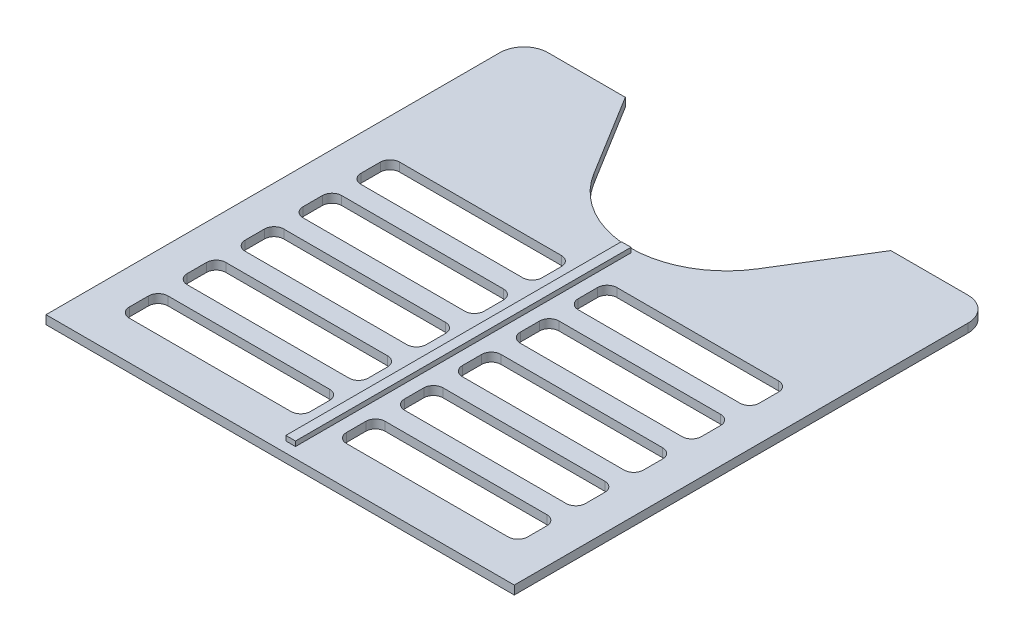
from build123d import *

# Parameters (mm, degrees)
GRUNDK_RPER_DEPTH = 1.8
L_FTUNGEN_DEPTH   = 1.8
SKIZZE4_W         = 2
SKIZZE4_H         = 69.501766887
STREBE_DEPTH      = 1


with BuildPart() as part:
    # Skizze2 → Grundkörper (new body)
    with BuildSketch(Plane(origin=(0, 0, 0), x_dir=(1, 0, 0), z_dir=(0, 1, 0))):
        with BuildLine():
            Line((-43.5, 50), (-27.5, 50))
            Line((-27.5, 50), (-17.028881642, 33))
            ThreePointArc((-17.028881642, 33), (0, 23.488907952), (17.028881642, 33))
            Line((17.028881642, 33), (27.5, 50))
            Line((27.5, 50), (43.5, 50))
            ThreePointArc((43.5, 50), (47.035533906, 48.535533906), (48.5, 45))
            Line((48.5, 45), (48.5, -49))
            Line((48.5, -49), (-48.5, -49))
            Line((-48.5, -49), (-48.5, 45))
            ThreePointArc((-48.5, 45), (-47.035533906, 48.535533906), (-43.5, 50))
        make_face()
    extrude(amount=GRUNDK_RPER_DEPTH)

    # Skizze3 → Lüftungen (cut)
    with BuildSketch(Plane(origin=(0, 1.8, 0), x_dir=(1, 0, 0), z_dir=(0, 1, 0))):
        with BuildLine():
            Line((-39.25, 15), (-5.75, 15))
            ThreePointArc((-5.75, 15), (-4.335786438, 14.414213562), (-3.75, 13))
            Line((-3.75, 13), (-3.75, 9))
            ThreePointArc((-3.75, 9), (-4.335786438, 7.585786438), (-5.75, 7))
            Line((-5.75, 7), (-39.25, 7))
            ThreePointArc((-39.25, 7), (-40.664213562, 7.585786438), (-41.25, 9))
            Line((-41.25, 9), (-41.25, 13))
            ThreePointArc((-41.25, 13), (-40.664213562, 14.414213562), (-39.25, 15))
        make_face()
        with BuildLine():
            Line((3.75, 13), (3.75, 9))
            ThreePointArc((3.75, 9), (4.335786438, 7.585786438), (5.75, 7))
            Line((5.75, 7), (39.25, 7))
            ThreePointArc((39.25, 7), (40.664213562, 7.585786438), (41.25, 9))
            Line((41.25, 9), (41.25, 13))
            ThreePointArc((41.25, 13), (40.664213562, 14.414213562), (39.25, 15))
            Line((39.25, 15), (5.75, 15))
            ThreePointArc((5.75, 15), (4.335786438, 14.414213562), (3.75, 13))
        make_face()
        with BuildLine():
            Line((3.75, 1), (3.75, -3))
            ThreePointArc((3.75, -3), (4.335786438, -4.414213562), (5.75, -5))
            Line((5.75, -5), (39.25, -5))
            ThreePointArc((39.25, -5), (40.664213562, -4.414213562), (41.25, -3))
            Line((41.25, -3), (41.25, 1))
            ThreePointArc((41.25, 1), (40.664213562, 2.414213562), (39.25, 3))
            Line((39.25, 3), (5.75, 3))
            ThreePointArc((5.75, 3), (4.335786438, 2.414213562), (3.75, 1))
        make_face()
        with BuildLine():
            Line((3.75, -11), (3.75, -15))
            ThreePointArc((3.75, -15), (4.335786438, -16.414213562), (5.75, -17))
            Line((5.75, -17), (39.25, -17))
            ThreePointArc((39.25, -17), (40.664213562, -16.414213562), (41.25, -15))
            Line((41.25, -15), (41.25, -11))
            ThreePointArc((41.25, -11), (40.664213562, -9.585786438), (39.25, -9))
            Line((39.25, -9), (5.75, -9))
            ThreePointArc((5.75, -9), (4.335786438, -9.585786438), (3.75, -11))
        make_face()
        with BuildLine():
            Line((3.75, -23), (3.75, -27))
            ThreePointArc((3.75, -27), (4.335786438, -28.414213562), (5.75, -29))
            Line((5.75, -29), (39.25, -29))
            ThreePointArc((39.25, -29), (40.664213562, -28.414213562), (41.25, -27))
            Line((41.25, -27), (41.25, -23))
            ThreePointArc((41.25, -23), (40.664213562, -21.585786438), (39.25, -21))
            Line((39.25, -21), (5.75, -21))
            ThreePointArc((5.75, -21), (4.335786438, -21.585786438), (3.75, -23))
        make_face()
        with BuildLine():
            Line((3.75, -35), (3.75, -39))
            ThreePointArc((3.75, -39), (4.335786438, -40.414213562), (5.75, -41))
            Line((5.75, -41), (39.25, -41))
            ThreePointArc((39.25, -41), (40.664213562, -40.414213562), (41.25, -39))
            Line((41.25, -39), (41.25, -35))
            ThreePointArc((41.25, -35), (40.664213562, -33.585786438), (39.25, -33))
            Line((39.25, -33), (5.75, -33))
            ThreePointArc((5.75, -33), (4.335786438, -33.585786438), (3.75, -35))
        make_face()
        with BuildLine():
            Line((-41.25, 1), (-41.25, -3))
            ThreePointArc((-41.25, -3), (-40.664213562, -4.414213562), (-39.25, -5))
            Line((-39.25, -5), (-5.75, -5))
            ThreePointArc((-5.75, -5), (-4.335786438, -4.414213562), (-3.75, -3))
            Line((-3.75, -3), (-3.75, 1))
            ThreePointArc((-3.75, 1), (-4.335786438, 2.414213562), (-5.75, 3))
            Line((-5.75, 3), (-39.25, 3))
            ThreePointArc((-39.25, 3), (-40.664213562, 2.414213562), (-41.25, 1))
        make_face()
        with BuildLine():
            Line((-41.25, -11), (-41.25, -15))
            ThreePointArc((-41.25, -15), (-40.664213562, -16.414213562), (-39.25, -17))
            Line((-39.25, -17), (-5.75, -17))
            ThreePointArc((-5.75, -17), (-4.335786438, -16.414213562), (-3.75, -15))
            Line((-3.75, -15), (-3.75, -11))
            ThreePointArc((-3.75, -11), (-4.335786438, -9.585786438), (-5.75, -9))
            Line((-5.75, -9), (-39.25, -9))
            ThreePointArc((-39.25, -9), (-40.664213562, -9.585786438), (-41.25, -11))
        make_face()
        with BuildLine():
            Line((-41.25, -23), (-41.25, -27))
            ThreePointArc((-41.25, -27), (-40.664213562, -28.414213562), (-39.25, -29))
            Line((-39.25, -29), (-5.75, -29))
            ThreePointArc((-5.75, -29), (-4.335786438, -28.414213562), (-3.75, -27))
            Line((-3.75, -27), (-3.75, -23))
            ThreePointArc((-3.75, -23), (-4.335786438, -21.585786438), (-5.75, -21))
            Line((-5.75, -21), (-39.25, -21))
            ThreePointArc((-39.25, -21), (-40.664213562, -21.585786438), (-41.25, -23))
        make_face()
        with BuildLine():
            Line((-41.25, -35), (-41.25, -39))
            ThreePointArc((-41.25, -39), (-40.664213562, -40.414213562), (-39.25, -41))
            Line((-39.25, -41), (-5.75, -41))
            ThreePointArc((-5.75, -41), (-4.335786438, -40.414213562), (-3.75, -39))
            Line((-3.75, -39), (-3.75, -35))
            ThreePointArc((-3.75, -35), (-4.335786438, -33.585786438), (-5.75, -33))
            Line((-5.75, -33), (-39.25, -33))
            ThreePointArc((-39.25, -33), (-40.664213562, -33.585786438), (-41.25, -35))
        make_face()
    extrude(amount=-L_FTUNGEN_DEPTH, mode=Mode.SUBTRACT)

    # Skizze4 → Strebe (add)
    with BuildSketch(Plane(origin=(0, 1.8, 0), x_dir=(1, 0, 0), z_dir=(0, 1, 0))):
        with Locations((0, -12.068236179)):
            Rectangle(SKIZZE4_W, SKIZZE4_H)
    extrude(amount=STREBE_DEPTH)


solid = part.part
